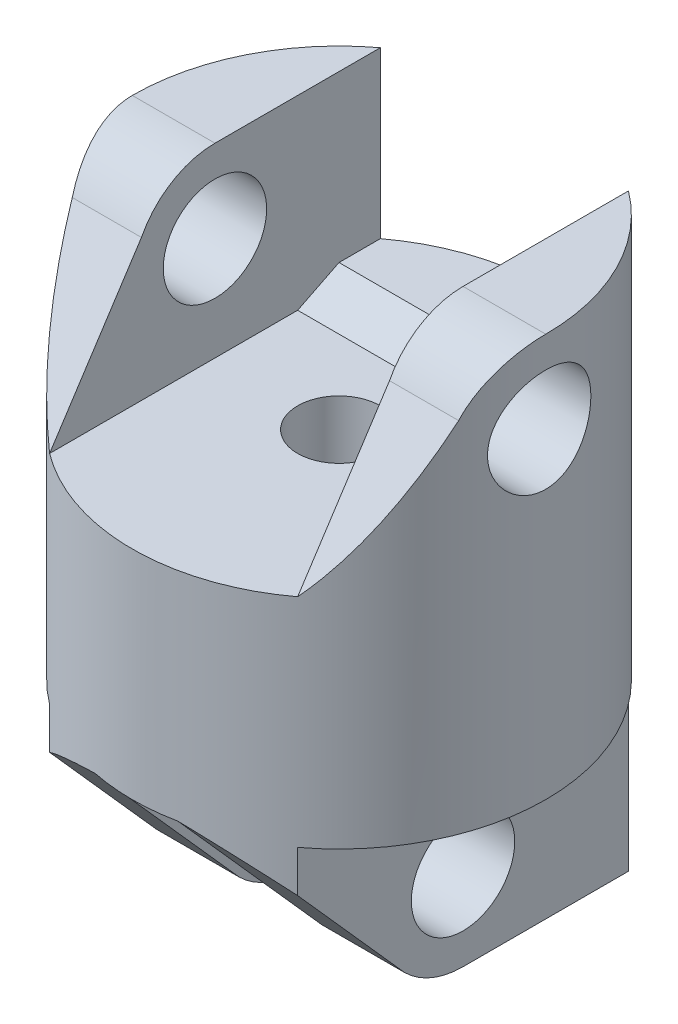
from build123d import *

# Parameters (mm, degrees)
SKETCH1_R               = 12.7
BOSS_EXTRUDE1_DEPTH     = 36.195
CUT_EXTRUDE1_START      = -11.43
CUT_EXTRUDE1_DEPTH      = 11.43
CUT_EXTRUDE2_DEPTH      = 11.43
CUT_EXTRUDE3_DEPTH      = 44.408183848
CUT_EXTRUDE3_DEPTH_BACK = 44.408183848
SKETCH4_R               = 3.175
SKETCH5_R               = 2.54
CUT_EXTRUDE4_DEPTH      = 31.592241419
BOSS_EXTRUDE2_REACH     = 45.408
BOSS_EXTRUDE3_DEPTH     = 1.27


with BuildPart() as part:
    # Sketch1 → Boss-Extrude1 (new body)
    with BuildSketch(Plane(origin=(0, 0, 0), x_dir=(1, 0, 0), z_dir=(0, 1, 0))):
        with Locations(Location((0, 0, 0), (0, 0, 270))):
            Circle(SKETCH1_R)
    extrude(amount=BOSS_EXTRUDE1_DEPTH)

    # Sketch2 → Cut-Extrude1 (cut)
    with BuildSketch(Plane(origin=(0, 36.195, 0), x_dir=(1, 0, 0), z_dir=(0, 1, 0)).offset(CUT_EXTRUDE1_START)):
        with BuildLine():
            Line((7.62, 10.16), (7.62, -10.16))
            ThreePointArc((7.62, -10.16), (0, -12.7), (-7.62, -10.16))
            Line((-7.62, -10.16), (-7.62, 10.16))
            ThreePointArc((-7.62, 10.16), (0, 12.7), (7.62, 10.16))
        make_face()
    extrude(amount=CUT_EXTRUDE1_DEPTH, mode=Mode.SUBTRACT)

    # Sketch3 → Cut-Extrude2 (cut)
    with BuildSketch(Plane.XZ):
        with BuildLine():
            Line((-2.54, 12.443407893), (-2.54, -12.443407893))
            ThreePointArc((-2.54, -12.443407893), (0, -12.7), (2.54, -12.443407893))
            Line((2.54, -12.443407893), (2.54, 12.443407893))
            ThreePointArc((2.54, 12.443407893), (0, 12.7), (-2.54, 12.443407893))
        make_face()
        with BuildLine():
            Line((-7.62, 10.16), (-7.62, -10.16))
            ThreePointArc((-7.62, -10.16), (-12.7, 0), (-7.62, 10.16))
        make_face()
        with BuildLine():
            Line((7.62, 10.16), (7.62, -10.16))
            ThreePointArc((7.62, -10.16), (12.7, 0), (7.62, 10.16))
        make_face()
    extrude(amount=-CUT_EXTRUDE2_DEPTH, mode=Mode.SUBTRACT)

    # Sketch4 → Cut-Extrude3 (cut, two sides: drawn at the far end of the back side and taken through both)
    with BuildSketch(Plane(origin=(-7.62, 0, 0), x_dir=(0, 0, -1), z_dir=(1, 0, 0)).offset(-CUT_EXTRUDE3_DEPTH_BACK)):
        with Locations(Location((0, 31.115, 0), (0, 0, 270))):
            Circle(SKETCH4_R)
        with Locations((0, 5.08)):
            Circle(SKETCH4_R)
        with BuildLine():
            Line((-10.16, 24.765), (-4.517844979, 33.437816554))
            ThreePointArc((-4.517844979, 33.437816554), (-2.646364667, 35.451260376), (0, 36.195))
            Line((0, 36.195), (-10.16, 36.195))
            Line((-10.16, 36.195), (-10.16, 24.765))
        make_face()
        with BuildLine():
            Line((0, 0), (-12.443407893, 0))
            Line((-12.443407893, 0), (-12.443407893, 11.43))
            Line((-12.443407893, 11.43), (-3.592102448, 1.487897552))
            ThreePointArc((-3.592102448, 1.487897552), (-1.944031836, 0.386691975), (0, 0))
        make_face()
    extrude(amount=CUT_EXTRUDE3_DEPTH + CUT_EXTRUDE3_DEPTH_BACK, mode=Mode.SUBTRACT)

    # Sketch5 → Cut-Extrude4 (cut, through all)
    with BuildSketch(Plane(origin=(0, 24.765, 0), x_dir=(1, 0, 0), z_dir=(0, 1, 0))):
        with Locations(Location((0, 0, 0), (0, 0, 270))):
            Circle(SKETCH5_R)
    extrude(amount=-CUT_EXTRUDE4_DEPTH, mode=Mode.SUBTRACT)

    # Boss-Extrude2: up to this face of the body (flat: up to its plane)
    boss_extrude2_end = Plane(part.part.faces().sort_by_distance((7.62, 24.998141009, 0))[0])
    # Sketch6 → Boss-Extrude2 (add, up to the picked face)
    with BuildSketch(Plane(origin=(-7.62, 0, 0), x_dir=(0, 0, -1), z_dir=(1, 0, 0)), mode=Mode.PRIVATE) as boss_extrude2_sk1:
        Polygon((5.08, 24.765), (10.16, 24.765), (10.16, 26.035), (7.62, 26.035), align=None)
    boss_extrude2_tool1 = split(extrude(boss_extrude2_sk1.sketch, amount=BOSS_EXTRUDE2_REACH, mode=Mode.PRIVATE), bisect_by=boss_extrude2_end, keep=Keep.BOTH, mode=Mode.PRIVATE)
    add(boss_extrude2_tool1.solids().sort_by(Axis((-7.62, 25.329444, -8.184444), (1, 0, 0)))[0])

    # Sketch7 → Boss-Extrude3 (add)
    with BuildSketch(Plane(origin=(0, 24.765, 0), x_dir=(1, 0, 0), z_dir=(0, 1, 0))):
        with BuildLine():
            Line((-7.62, 10.16), (7.62, 10.16))
            ThreePointArc((7.62, 10.16), (0, 12.7), (-7.62, 10.16))
        make_face()
    extrude(amount=BOSS_EXTRUDE3_DEPTH)


solid = part.part
